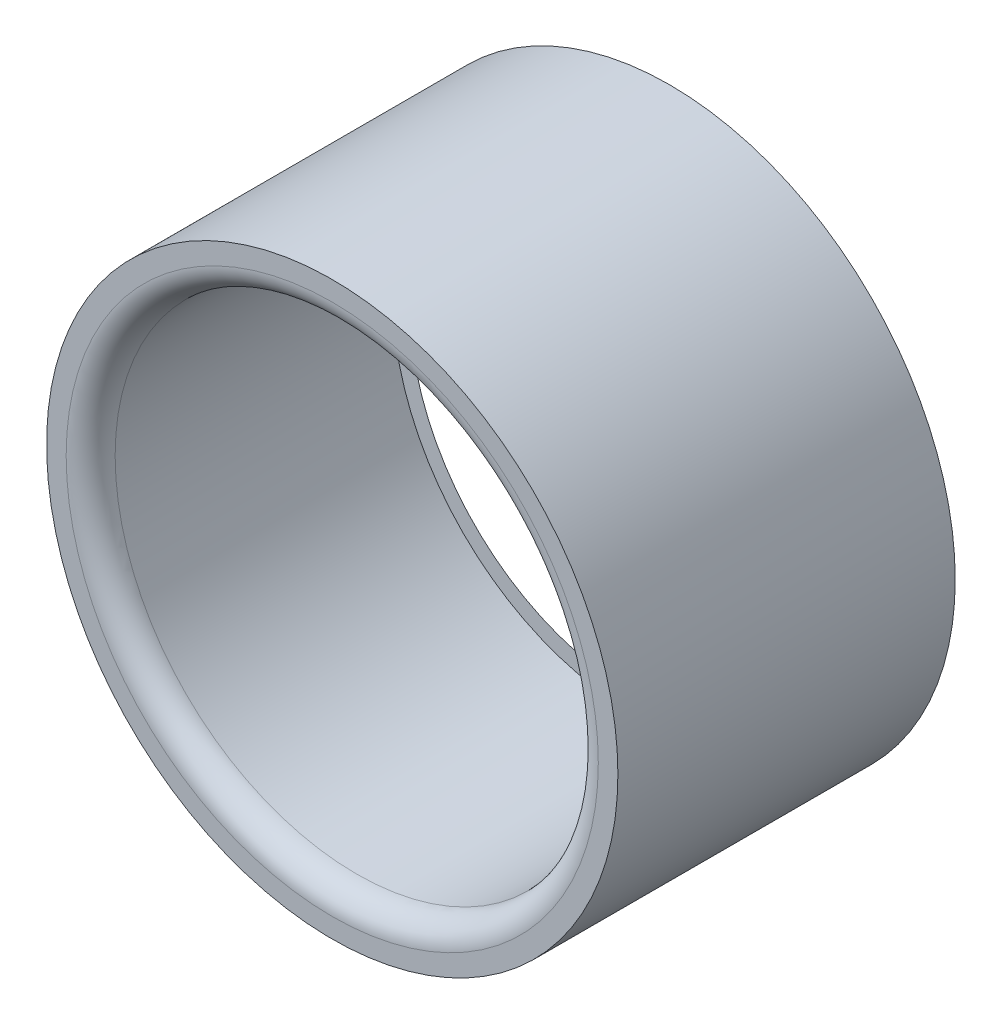
from build123d import *

# Parameters (mm, degrees)
SKETCH1_R           = 31
SKETCH1_R_2         = 29.75
BOSS_EXTRUDE1_DEPTH = 29
SKETCH2_R           = 32.5
SKETCH2_R_2         = 29.6
BOSS_EXTRUDE3_DEPTH = 35
FILLET2_R           = 2
SKETCH3_R           = 32.5
CUT_EXTRUDE1_DEPTH  = 3.5
SKETCH4_R           = 29.6
SKETCH4_R_2         = 27.5
BOSS_EXTRUDE4_DEPTH = 15
CUT_EXTRUDE2_START  = -33
SKETCH5_R           = 29.6
CUT_EXTRUDE2_DEPTH  = 33
SKETCH6_R           = 35
SKETCH6_R_2         = 29.6
BOSS_EXTRUDE5_DEPTH = 37
FILLET3_R           = 3


with BuildPart() as part:
    # Sketch1 → Boss-Extrude1 (new body)
    with BuildSketch(Plane.XY):
        with Locations(Location((0, 0, 0), (0, 0, 180))):
            Circle(SKETCH1_R)
        with Locations(Location((0, 0, 0), (0, 0, 180))):
            Circle(SKETCH1_R_2, mode=Mode.SUBTRACT)
    extrude(amount=BOSS_EXTRUDE1_DEPTH)

    # Sketch2 → Boss-Extrude3 (add)
    with BuildSketch(Plane.XY.offset(29)):
        Circle(SKETCH2_R)
        Circle(SKETCH2_R_2, mode=Mode.SUBTRACT)
    extrude(amount=-BOSS_EXTRUDE3_DEPTH)

    # Fillet2
    fillet2_edges = [part.edges().sort_by_distance(p)[0] for p in [
        (-29.6, 0, -6),
    ]]
    fillet(fillet2_edges, radius=FILLET2_R)

    # Sketch3 → Cut-Extrude1 (cut)
    with BuildSketch(Plane.XY.offset(29)):
        Circle(SKETCH3_R)
    extrude(amount=-CUT_EXTRUDE1_DEPTH, mode=Mode.SUBTRACT)

    # Sketch4 → Boss-Extrude4 (add)
    with BuildSketch(Plane.XY.offset(25.5)):
        Circle(SKETCH4_R)
        Circle(SKETCH4_R_2, mode=Mode.SUBTRACT)
    extrude(amount=-BOSS_EXTRUDE4_DEPTH)

    # Sketch5 → Cut-Extrude2 (cut)
    with BuildSketch(Plane(origin=(0, 0, 10.5), x_dir=(-1, 0, 0), z_dir=(0, 0, -1)).offset(CUT_EXTRUDE2_START)):
        with Locations(Location((0, 0, 0), (0, 0, 180))):
            Circle(SKETCH5_R)
    extrude(amount=CUT_EXTRUDE2_DEPTH, mode=Mode.SUBTRACT)

    # Sketch6 → Boss-Extrude5 (add)
    with BuildSketch(Plane.XY.offset(25.5)):
        Circle(SKETCH6_R)
        Circle(SKETCH6_R_2, mode=Mode.SUBTRACT)
    extrude(amount=-BOSS_EXTRUDE5_DEPTH)

    # Sketch7 → Revolve1 (revolve)
    with BuildSketch(Plane(origin=(0, 0, 0), x_dir=(1, 0, 0), z_dir=(0, 1, 0)), mode=Mode.PRIVATE) as revolve1_sk:
        Polygon((-27.5, 11.5), (-35, 15.830127019), (-35, 11.5), align=None)
    revolve(revolve1_sk.sketch.rotate(Axis((0, 0, -15.830127019), (0, 0, 1)), 180), axis=Axis((0, 0, -15.830127019), (0, 0, 1)))

    # Fillet3
    fillet3_edges = [part.edges().sort_by_distance(p)[0] for p in [
        (-29.6, 0, 25.5),
    ]]
    fillet(fillet3_edges, radius=FILLET3_R)


solid = part.part
